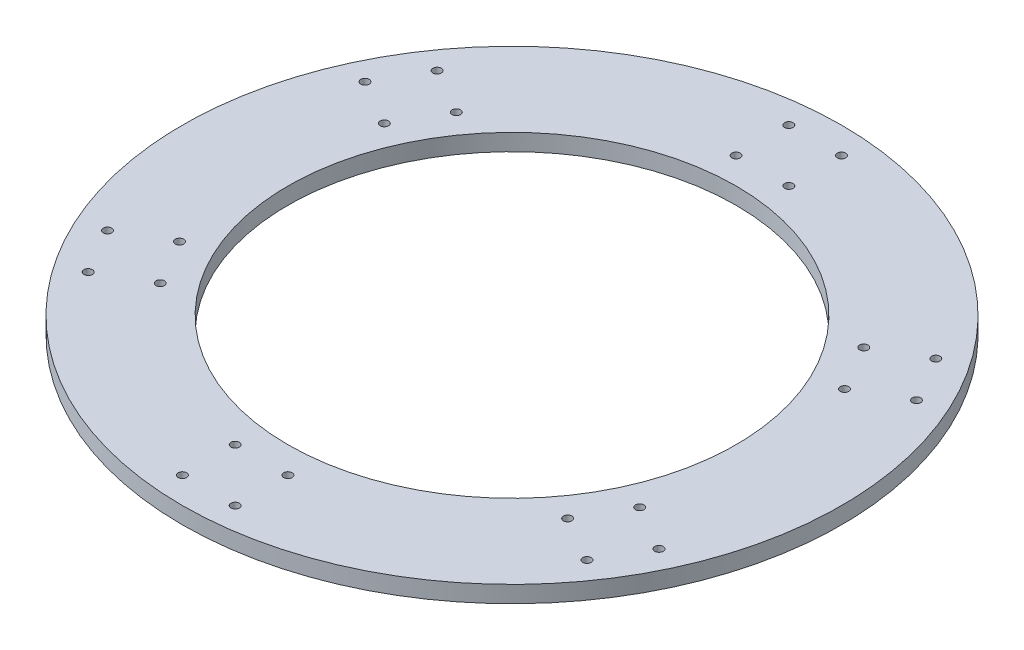
from build123d import *

# Parameters (mm, degrees)
SKETCH1_R            = 125
BOSS_EXTRUDE1_DEPTH  = 6.35
SKETCH2_R            = 85
CUT_EXTRUDE1_DEPTH   = 177.890707783
M3_CLEARANCE_HOLE1_D = 3.2


with BuildPart() as part:
    # Sketch1 → Boss-Extrude1 (new body)
    with BuildSketch(Plane(origin=(0, 0, 0), x_dir=(1, 0, 0), z_dir=(0, 1, 0))):
        with Locations(Location((0, 0, 0), (0, 0, 270))):
            Circle(SKETCH1_R)
    extrude(amount=BOSS_EXTRUDE1_DEPTH)

    # Sketch2 → Cut-Extrude1 (cut, through all)
    with BuildSketch(Plane(origin=(0, 0, 0), x_dir=(1, 0, 0), z_dir=(0, 1, 0))):
        with Locations(Location((0, 0, 0), (0, 0, 270))):
            Circle(SKETCH2_R)
    extrude(amount=CUT_EXTRUDE1_DEPTH, mode=Mode.SUBTRACT)

    # M3 Clearance Hole1 (through all)
    with Locations(Plane(origin=(0, 0, 0), x_dir=(-1, 0, 0), z_dir=(0, -1, 0))):
        with Locations((10, -95), (-10, -95), (10, -115), (-10, -115), (-77.27241336, -56.160254038), (-87.27241336, -38.839745962), (-94.592921435, -66.160254038), (-104.592921435, -48.839745962), (-87.27241336, 38.839745962), (-77.27241336, 56.160254038), (-104.592921435, 48.839745962), (-94.592921435, 66.160254038), (0, 0), (-10, 95), (10, 95), (-10, 115), (10, 115), (77.27241336, 56.160254038), (87.27241336, 38.839745962), (94.592921435, 66.160254038), (104.592921435, 48.839745962), (87.27241336, -38.839745962), (77.27241336, -56.160254038), (104.592921435, -48.839745962), (94.592921435, -66.160254038)):
            Hole(M3_CLEARANCE_HOLE1_D / 2)


solid = part.part
